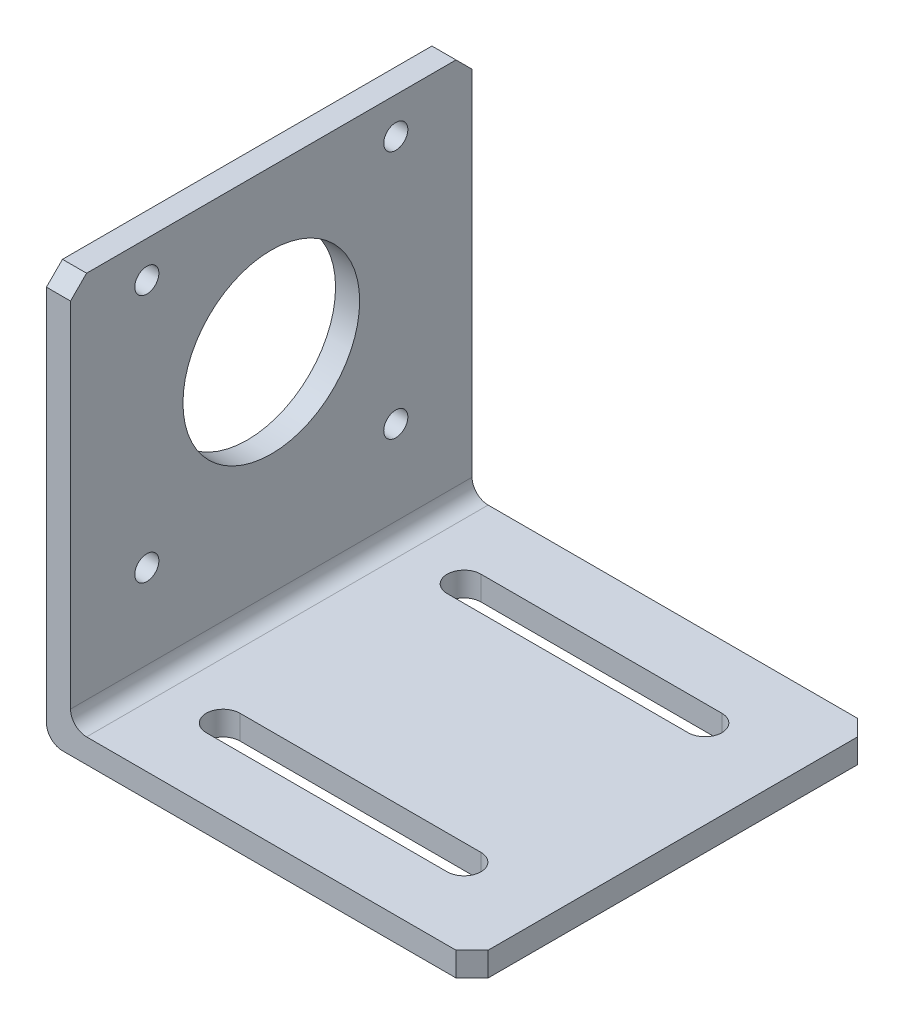
from build123d import *

# Parameters (mm, degrees)
Y_KSEKLIK_EKSTR_ZYON1_DEPTH = 50
IZIM2_R                     = 11
IZIM2_R_2                   = 1.5
KES_EKSTR_ZYON1_DEPTH       = 88.183714076
KES_EKSTR_ZYON2_DEPTH       = 88.252507127
KES_EKSTR_ZYON2_DEPTH_BACK  = 10
KES_EKSTR_ZYON3_DEPTH       = 88.183714076
KES_EKSTR_ZYON4_DEPTH       = 88.252507127


with BuildPart() as part:
    # Çizim1 → Yükseklik-Ekstrüzyon1 (new body)
    with BuildSketch(Plane.XY):
        with BuildLine():
            Line((0, 51), (0, 2))
            ThreePointArc((0, 2), (0.585786438, 0.585786438), (2, 0))
            Line((2, 0), (53, 0))
            Line((53, 0), (53, 3))
            Line((53, 3), (5, 3))
            ThreePointArc((5, 3), (3.585786438, 3.585786438), (3, 5))
            Line((3, 5), (3, 51))
            Line((3, 51), (0, 51))
        make_face()
    extrude(amount=Y_KSEKLIK_EKSTR_ZYON1_DEPTH)

    # Çizim2 → Kes-Ekstrüzyon1 (cut, through all)
    with BuildSketch(Plane(origin=(3, 0, 0), x_dir=(0, 0, -1), z_dir=(1, 0, 0))):
        with Locations((-25, 31)):
            Circle(IZIM2_R)
        with Locations((-9.5, 46.5)):
            Circle(IZIM2_R_2)
        with Locations(Location((-40.5, 46.5, 0), (0, 0, 180))):
            Circle(IZIM2_R_2)
        with Locations(Location((-9.5, 15.5, 0), (0, 0, 180))):
            Circle(IZIM2_R_2)
        with Locations((-40.5, 15.5)):
            Circle(IZIM2_R_2)
    extrude(amount=-KES_EKSTR_ZYON1_DEPTH, mode=Mode.SUBTRACT)

    # Çizim3 → Kes-Ekstrüzyon2 (cut, two sides: drawn at the far end of the back side and taken through both)
    with BuildSketch(Plane(origin=(0, 3, 0), x_dir=(1, 0, 0), z_dir=(0, 1, 0)).offset(-KES_EKSTR_ZYON2_DEPTH_BACK)):
        with BuildLine():
            Line((42, -12.1), (12, -12.1))
            ThreePointArc((12, -12.1), (9.9, -10), (12, -7.9))
            Line((12, -7.9), (42, -7.9))
            ThreePointArc((42, -7.9), (44.1, -10), (42, -12.1))
        make_face()
        with BuildLine():
            Line((42, -37.9), (12, -37.9))
            ThreePointArc((12, -37.9), (9.9, -40), (12, -42.1))
            Line((12, -42.1), (42, -42.1))
            ThreePointArc((42, -42.1), (44.1, -40), (42, -37.9))
        make_face()
    extrude(amount=KES_EKSTR_ZYON2_DEPTH + KES_EKSTR_ZYON2_DEPTH_BACK, mode=Mode.SUBTRACT)

    # Çizim4 → Kes-Ekstrüzyon3 (cut, through all)
    with BuildSketch(Plane(origin=(3, 0, 0), x_dir=(0, 0, -1), z_dir=(1, 0, 0))):
        Polygon((-50, 49), (-50, 51), (-48, 51), align=None)
        Polygon((0, 49), (0, 51), (-2, 51), align=None)
    extrude(amount=-KES_EKSTR_ZYON3_DEPTH, mode=Mode.SUBTRACT)

    # Çizim5 → Kes-Ekstrüzyon4 (cut, through all)
    with BuildSketch(Plane(origin=(0, 3, 0), x_dir=(1, 0, 0), z_dir=(0, 1, 0))):
        Polygon((53, -48), (51, -50), (53, -50), align=None)
        Polygon((53, 0), (53, -2), (51, 0), align=None)
    extrude(amount=-KES_EKSTR_ZYON4_DEPTH, mode=Mode.SUBTRACT)


solid = part.part
